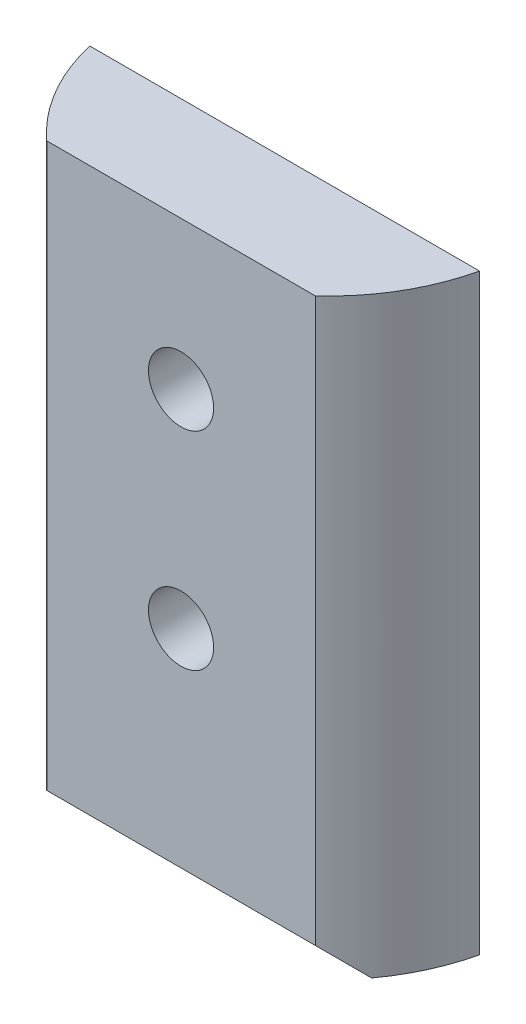
from build123d import *

# Parameters (mm, degrees)
EXTRUDE_1_DEPTH     = 20
SKETCH_3_R          = 1.1
CUT_EXTRUDE_1_DEPTH = 20
CHAMFER_1_SIZE      = 1


with BuildPart() as part:
    # 草图2 → 凸台-拉伸1 (new body)
    with BuildSketch(Plane(origin=(0, 0, 0), x_dir=(1, 0, 0), z_dir=(0, 1, 0))):
        with BuildLine():
            Line((6.581223291, -1.5), (-6.581223291, -1.5))
            ThreePointArc((-6.581223291, -1.5), (-5.826905037, -3.40729771), (-4.534589287, -5))
            Line((-4.534589287, -5), (4.534589287, -5))
            ThreePointArc((4.534589287, -5), (5.826905037, -3.40729771), (6.581223291, -1.5))
        make_face()
    extrude(amount=EXTRUDE_1_DEPTH)

    # 草图3 → 切除-拉伸1 (cut)
    with BuildSketch(Plane.XY.offset(5)):
        with Locations((0, 15)):
            Circle(SKETCH_3_R)
        with Locations((0, 8)):
            Circle(SKETCH_3_R)
    extrude(amount=-CUT_EXTRUDE_1_DEPTH, mode=Mode.SUBTRACT)

    # 倒角1
    chamfer_1_edges = [part.edges().sort_by_distance(p)[0] for p in [
        (0, 0, 5),
    ]]
    chamfer(chamfer_1_edges, length=CHAMFER_1_SIZE)


solid = part.part
